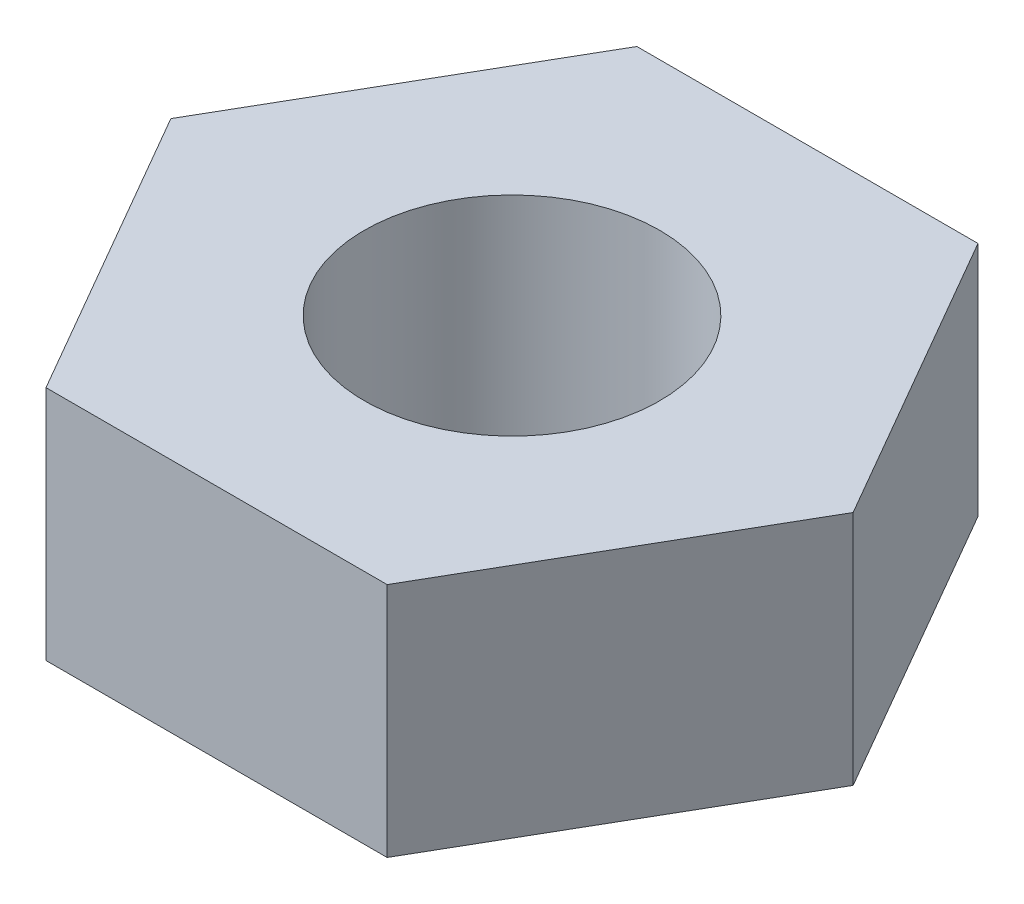
from build123d import *

# Parameters (mm, degrees)
EXTRUDE_1_DEPTH     = 1.6
SKETCH_3_R          = 1
CUT_EXTRUDE_1_DEPTH = 4.448671242


with BuildPart() as part:
    # 草图1 → 凸台-拉伸1 (new body)
    with BuildSketch(Plane(origin=(0, 0, 0), x_dir=(1, 0, 0), z_dir=(0, 1, 0))):
        Polygon((2.309401077, 0), (1.154700538, 2), (-1.154700538, 2), (-2.309401077, 0), (-1.154700538, -2), (1.154700538, -2), align=None)
    extrude(amount=EXTRUDE_1_DEPTH)

    # 草图3 → 切除-拉伸1 (cut, through all)
    with BuildSketch(Plane.XZ):
        Circle(SKETCH_3_R)
    extrude(amount=-CUT_EXTRUDE_1_DEPTH, mode=Mode.SUBTRACT)


solid = part.part
